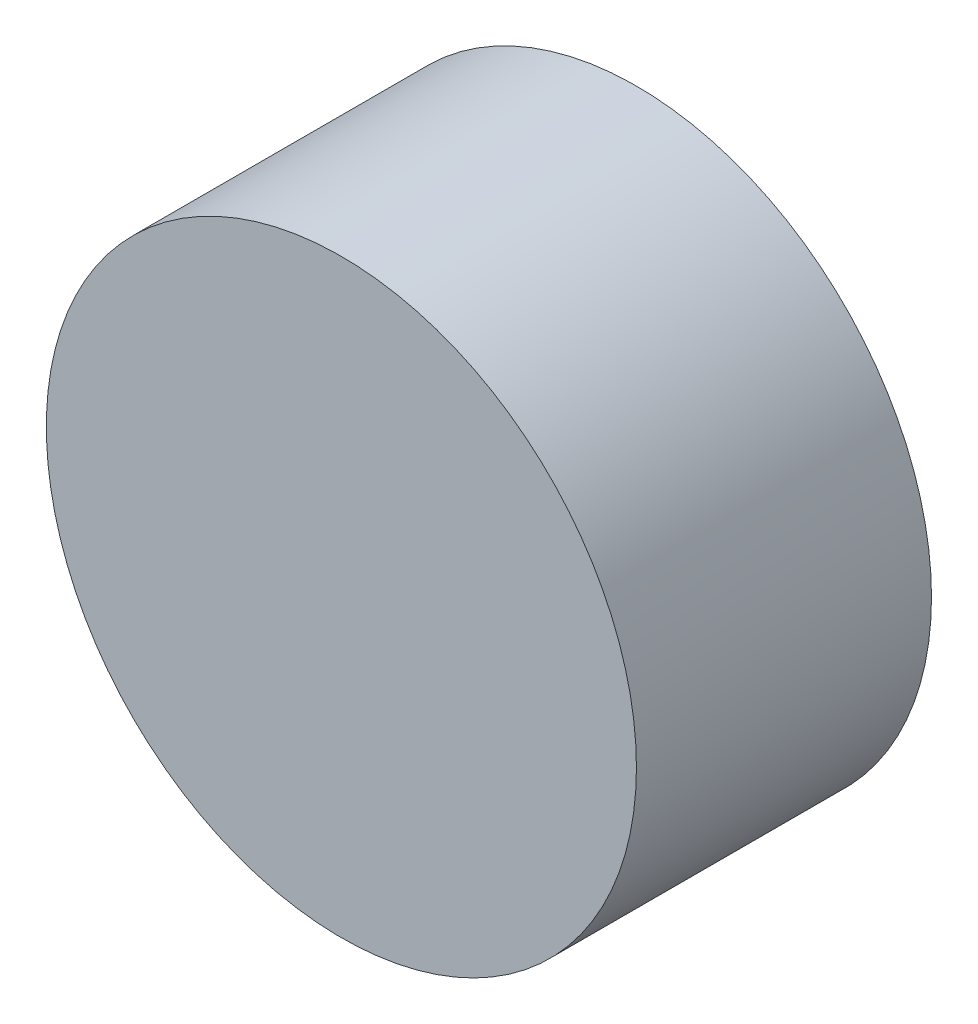
from build123d import *

# Parameters (mm, degrees)
SKETCH1_R           = 5
BOSS_EXTRUDE1_DEPTH = 5


with BuildPart() as part:
    # Sketch1 → Boss-Extrude1 (new body)
    with BuildSketch(Plane.XY):
        Circle(SKETCH1_R)
    extrude(amount=BOSS_EXTRUDE1_DEPTH)


solid = part.part
